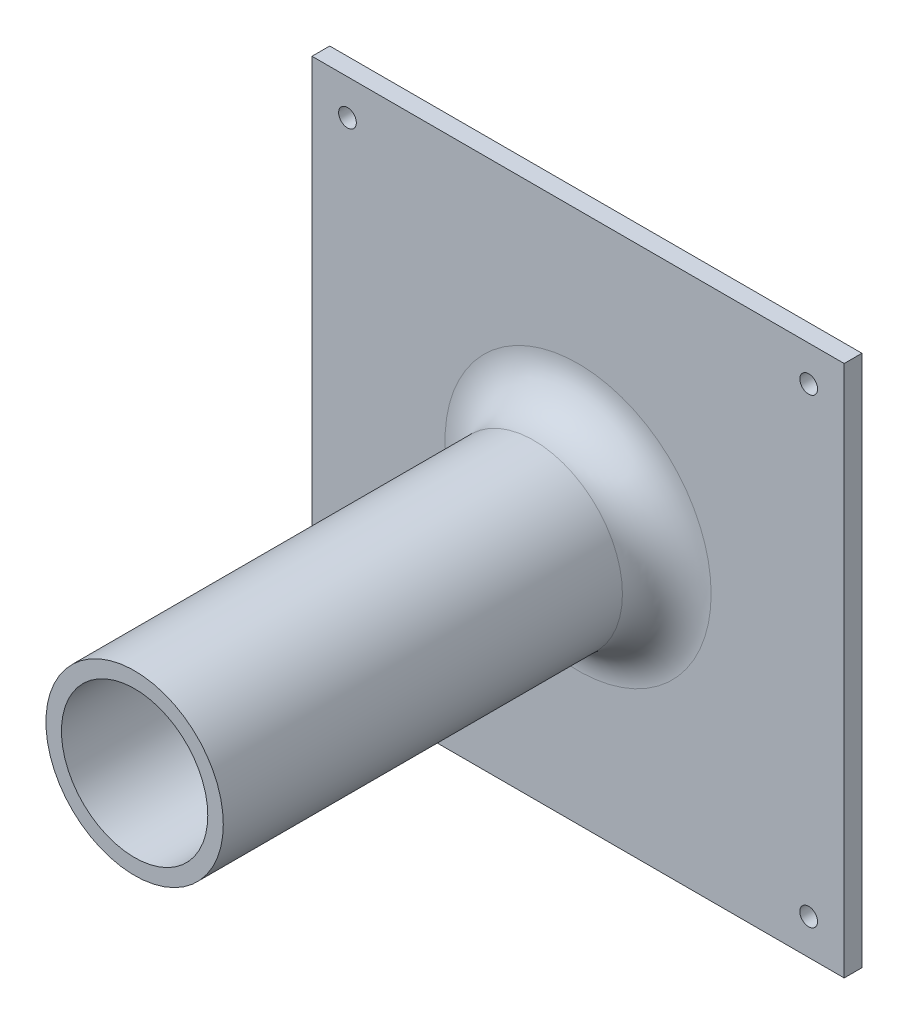
from build123d import *

# Parameters (mm, degrees)
ESQUISSE1_W        = 60
ESQUISSE1_H        = 60
ESQUISSE1_R        = 6
ESQUISSE1_R_2      = 1
BOSS_EXTRU_1_DEPTH = 2
ESQUISSE2_R        = 10
ESQUISSE2_R_2      = 8.25
BOSS_EXTRU_2_DEPTH = 50
CONG_1_R           = 5


with BuildPart() as part:
    # Esquisse1 → Boss.-Extru.1 (new body)
    with BuildSketch(Plane.XY):
        Rectangle(ESQUISSE1_W, ESQUISSE1_H)
        Circle(ESQUISSE1_R, mode=Mode.SUBTRACT)
        with Locations((-26, 26)):
            Circle(ESQUISSE1_R_2, mode=Mode.SUBTRACT)
        with Locations((26, 26)):
            Circle(ESQUISSE1_R_2, mode=Mode.SUBTRACT)
        with Locations((26, -26)):
            Circle(ESQUISSE1_R_2, mode=Mode.SUBTRACT)
        with Locations((-26, -26)):
            Circle(ESQUISSE1_R_2, mode=Mode.SUBTRACT)
    extrude(amount=BOSS_EXTRU_1_DEPTH)

    # Esquisse2 → Boss.-Extru.2 (add)
    with BuildSketch(Plane.XY.offset(2)):
        Circle(ESQUISSE2_R)
        Circle(ESQUISSE2_R_2, mode=Mode.SUBTRACT)
    extrude(amount=BOSS_EXTRU_2_DEPTH)

    # Congé1
    cong_1_edges = [part.edges().sort_by_distance(p)[0] for p in [
        (-10, 0, 2),
    ]]
    fillet(cong_1_edges, radius=CONG_1_R)


solid = part.part
